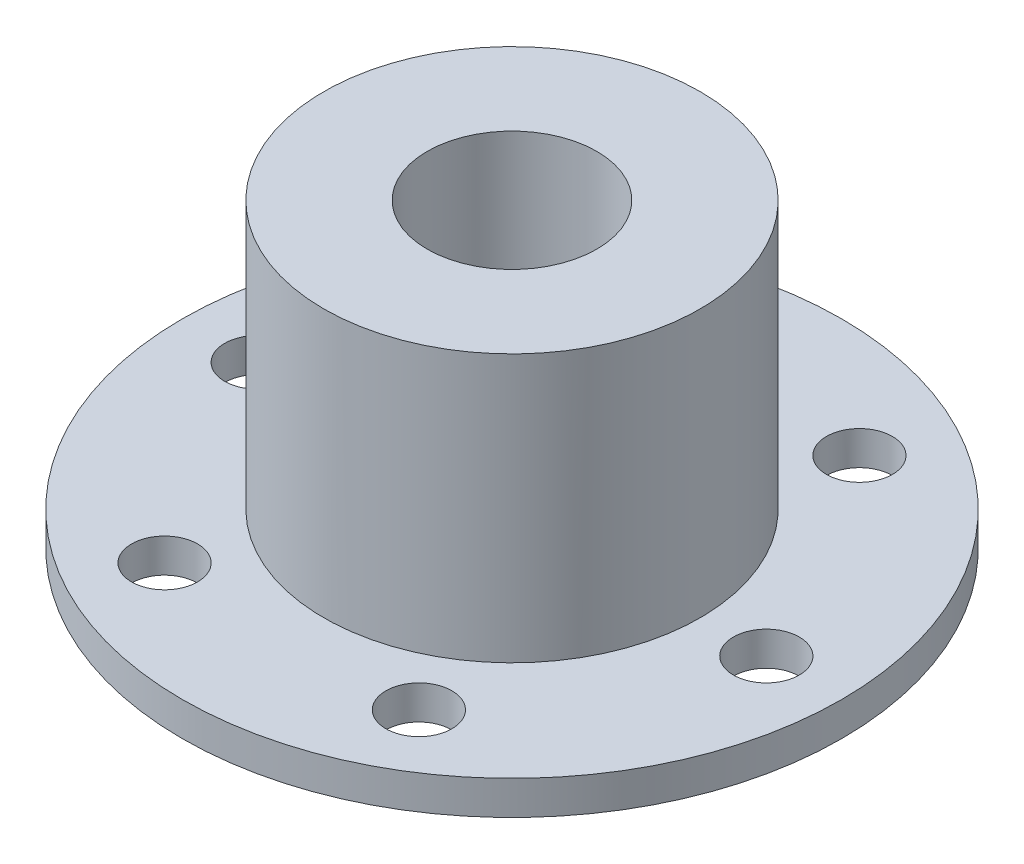
from build123d import *

# Parameters (mm, degrees)
SKETCH1_R           = 9.99
BOSS_EXTRUDE1_DEPTH = 16
SKETCH3_R           = 17.5
BOSS_EXTRUDE2_DEPTH = 1.8
SKETCH4_R           = 4.5
CUT_EXTRUDE1_DEPTH  = 16
SKETCH6_R           = 1.75
CUT_EXTRUDE2_DEPTH  = 1.8
CIRPATTERN1_COUNT   = 6


with BuildPart() as part:
    # Sketch1 → Boss-Extrude1 (new body)
    with BuildSketch(Plane(origin=(0, 0, 0), x_dir=(1, 0, 0), z_dir=(0, 1, 0))):
        with Locations(Location((0, 0, 0), (0, 0, 270))):
            Circle(SKETCH1_R)
    extrude(amount=BOSS_EXTRUDE1_DEPTH)

    # Sketch3 → Boss-Extrude2 (add)
    with BuildSketch(Plane.XZ):
        with Locations(Location((0, 0, 0), (0, 0, 270))):
            Circle(SKETCH3_R)
    extrude(amount=-BOSS_EXTRUDE2_DEPTH)

    # Sketch4 → Cut-Extrude1 (cut)
    with BuildSketch(Plane.XZ):
        with Locations(Location((0, 0, 0), (0, 0, 270))):
            Circle(SKETCH4_R)
    extrude(amount=-CUT_EXTRUDE1_DEPTH, mode=Mode.SUBTRACT)

    # Sketch6 → Cut-Extrude2 (cut)
    with BuildSketch(Plane.XZ):
        with Locations(Location((13.5, 0, 0), (0, 0, 270))):
            Circle(SKETCH6_R)
    cut_extrude2 = extrude(amount=-CUT_EXTRUDE2_DEPTH, mode=Mode.SUBTRACT)

    # CirPattern1: Cut-Extrude2 ×6 about axis
    cirpattern1_axis = Axis((0, 0, 0), (0, 1, 0))
    for i in range(1, CIRPATTERN1_COUNT):
        add(cut_extrude2.rotate(cirpattern1_axis, i * 360 / CIRPATTERN1_COUNT), mode=Mode.SUBTRACT)


solid = part.part
